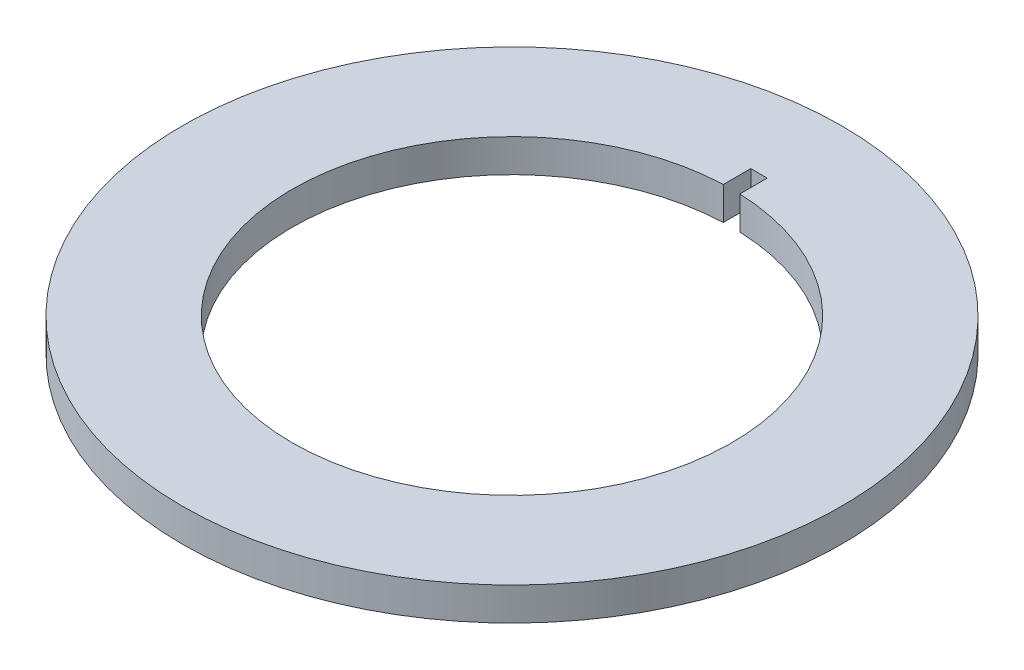
from build123d import *

# Parameters (mm, degrees)
ESQUISSE1_R        = 30
BOSS_EXTRU_1_DEPTH = 3


with BuildPart() as part:
    # Esquisse1 → Boss.-Extru.1 (new body)
    with BuildSketch(Plane(origin=(0, 0, 0), x_dir=(1, 0, 0), z_dir=(0, 1, 0))):
        with Locations(Location((0, 0, 0), (0, 0, 270))):
            Circle(ESQUISSE1_R)
        with BuildLine():
            Line((0.75, 22.487496526), (-0.75, 22.487496526))
            Line((-0.75, 22.487496526), (-0.75, 19.985932553))
            ThreePointArc((-0.75, 19.985932553), (0, -20), (0.75, 19.985932553))
            Line((0.75, 19.985932553), (0.75, 22.487496526))
        make_face(mode=Mode.SUBTRACT)
    extrude(amount=BOSS_EXTRU_1_DEPTH)


solid = part.part
